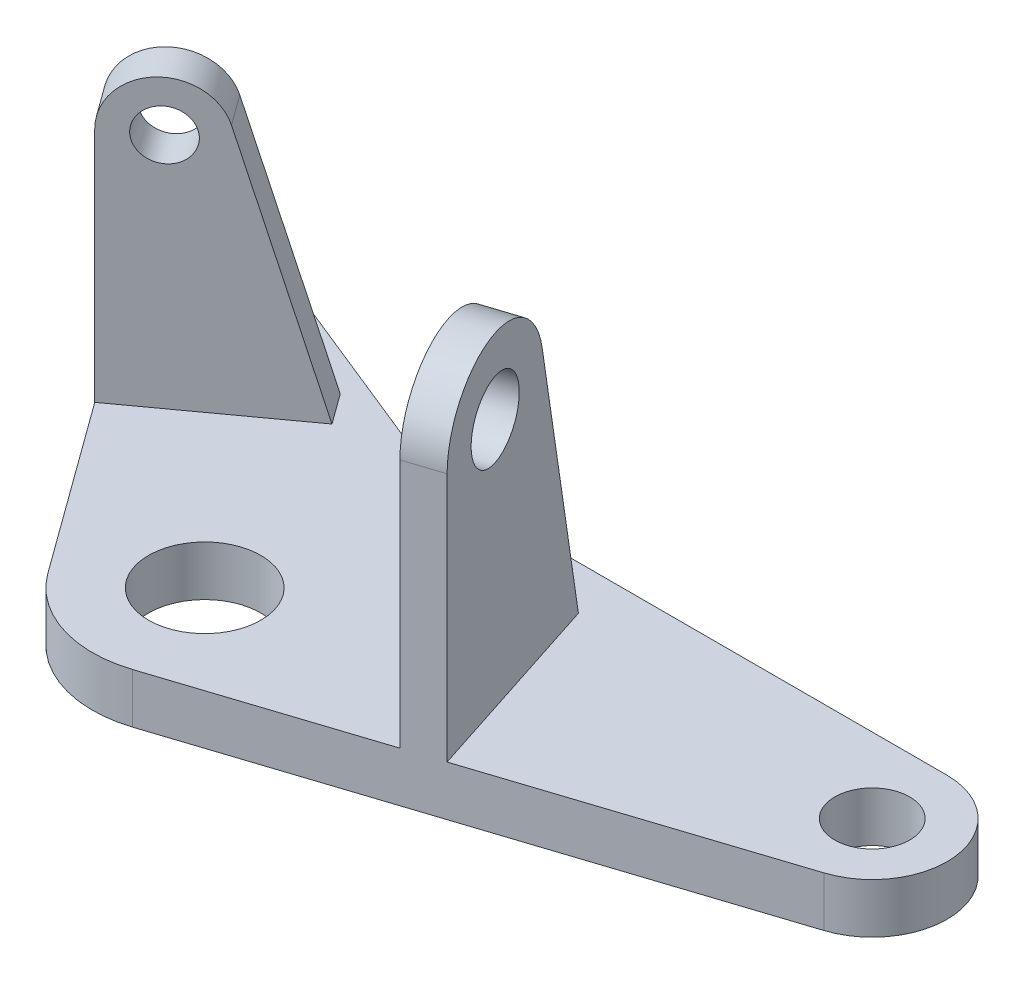
from build123d import *

# Parameters (mm, degrees)
SKETCH1_R           = 4
SKETCH1_R_2         = 6
SKETCH1_R_3         = 9
BOSS_EXTRUDE1_DEPTH = 8
SKETCH2_R           = 4
BOSS_EXTRUDE2_DEPTH = 3
SKETCH3_R           = 6
BOSS_EXTRUDE3_DEPTH = 3


with BuildPart() as part:
    # Sketch1 → Boss-Extrude1 (new body)
    with BuildSketch(Plane(origin=(0, 0, 0), x_dir=(1, 0, 0), z_dir=(0, 1, 0))):
        with BuildLine():
            Line((82, 0), (0, 0))
            Line((0, 0), (-45.003147253, 18.182451735))
            ThreePointArc((-45.003147253, 18.182451735), (-54.304086029, 15.690272701), (-54.472135955, 6.06269888))
            Line((-54.472135955, 6.06269888), (-18.061799059, -44.051830542))
            ThreePointArc((-18.061799059, -44.051830542), (-9.061799059, -50.590713294), (2.062812738, -50.590713294))
            Line((2.062812738, -50.590713294), (85.708203932, -23.412678196))
            ThreePointArc((85.708203932, -23.412678196), (93.852260087, -10.12278642), (82, 0))
        make_face()
        with Locations(Location((-48, 10.764980899, 0), (0, 0, 270))):
            Circle(SKETCH1_R, mode=Mode.SUBTRACT)
        with Locations(Location((82, -12, 0), (0, 0, 270))):
            Circle(SKETCH1_R_2, mode=Mode.SUBTRACT)
        with Locations(Location((-3.49949316, -33.471696, 0), (0, 0, 270))):
            Circle(SKETCH1_R_3, mode=Mode.SUBTRACT)
    extrude(amount=BOSS_EXTRUDE1_DEPTH)

    # Sketch2 → Boss-Extrude2 (add, symmetric)
    with BuildSketch(Plane(origin=(-7.04036219, 0, -9.690227231), x_dir=(0.809016994374944, 0, -0.5877852522924779), z_dir=(0.5877852522924779, 0, 0.809016994374944))):
        with BuildLine():
            Line((-40.505318717, 8), (-40.505318717, 46))
            ThreePointArc((-40.505318717, 46), (-33.618703524, 53.92214455), (-24.815225149, 48.205098847))
            Line((-24.815225149, 48.205098847), (-13.286598571, 8))
            Line((-13.286598571, 8), (-40.505318717, 8))
        make_face()
        with Locations(Location((-32.505318717, 46, 0), (0, 0, 180))):
            Circle(SKETCH2_R, mode=Mode.SUBTRACT)
    extrude(amount=BOSS_EXTRUDE2_DEPTH, both=True)

    # Sketch3 → Boss-Extrude3 (add, symmetric)
    with BuildSketch(Plane(origin=(22.186685165, 0, -7.208891004), x_dir=(-0.30901699437494223, 0, -0.9510565162951553), z_dir=(0.9510565162951552, 0, -0.3090169943749422))):
        with BuildLine():
            Line((-48.752071734, 8), (-48.752071734, 48))
            ThreePointArc((-48.752071734, 48), (-38.006413293, 59.934262744), (-25.014300525, 50.49494029))
            Line((-25.014300525, 50.49494029), (-15.981722129, 8))
            Line((-15.981722129, 8), (-48.752071734, 8))
        make_face()
        with Locations((-36.752071734, 48)):
            Circle(SKETCH3_R, mode=Mode.SUBTRACT)
    extrude(amount=BOSS_EXTRUDE3_DEPTH, both=True)


solid = part.part
